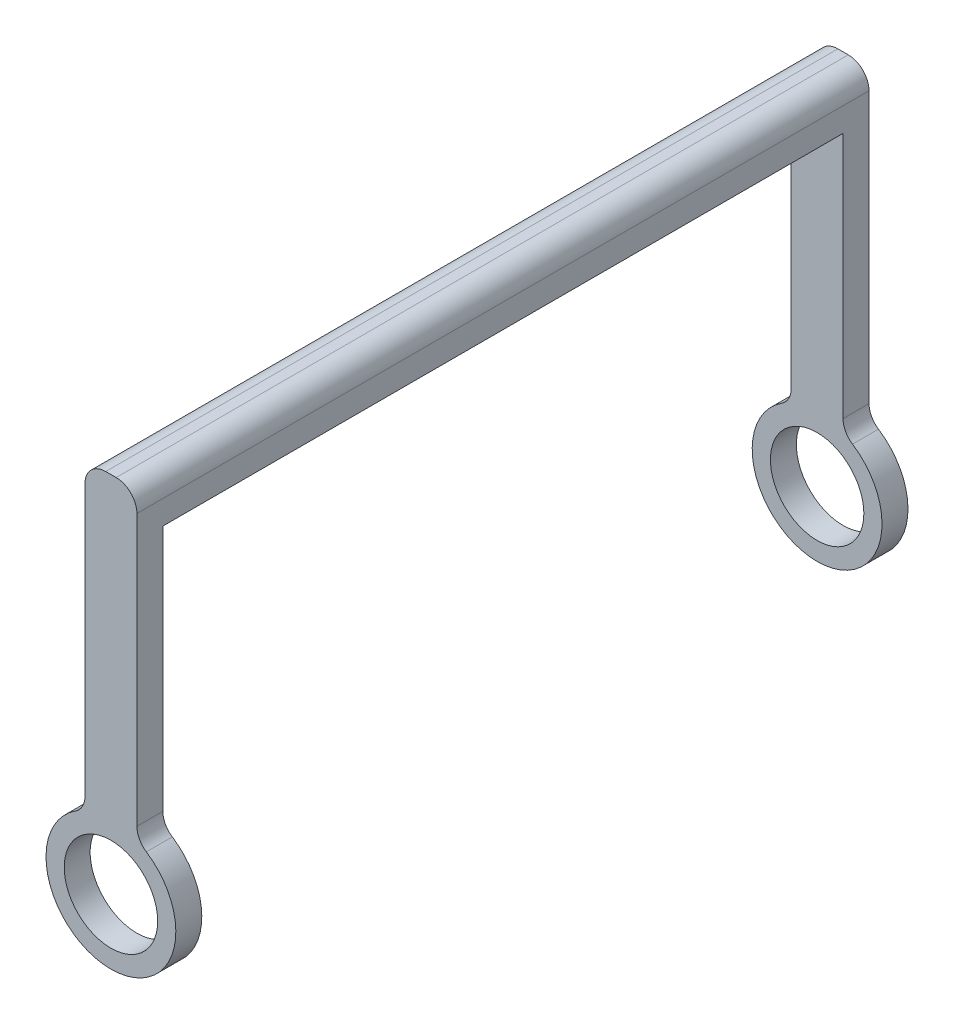
from build123d import *

# Parameters (mm, degrees)
SKETCH1_R           = 9
BOSS_EXTRUDE1_DEPTH = 2.5
BOSS_EXTRUDE2_START = 131
BOSS_EXTRUDE2_DEPTH = 131


with BuildPart() as part:
    # Sketch1 → Boss-Extrude1 (new, symmetric)
    with BuildSketch(Plane.XY):
        with BuildLine():
            Line((-5, 13.829316686), (-5, 66))
            ThreePointArc((-5, 66), (-3.828427125, 68.828427125), (-1, 70))
            Line((-1, 70), (1, 70))
            ThreePointArc((1, 70), (3.828427125, 68.828427125), (5, 66))
            Line((5, 66), (5, 13.829316686))
            ThreePointArc((5, 13.829316686), (5.483803708, 11.922391507), (6.818181818, 10.476755065))
            ThreePointArc((6.818181818, 10.476755065), (0, -12.5), (-6.818181818, 10.476755065))
            ThreePointArc((-6.818181818, 10.476755065), (-5.483803708, 11.922391507), (-5, 13.829316686))
        make_face()
        Circle(SKETCH1_R, mode=Mode.SUBTRACT)
    boss_extrude1 = extrude(amount=BOSS_EXTRUDE1_DEPTH, both=True)

    # Sketch2 → Boss-Extrude2 (add)
    with BuildSketch(Plane.XY.offset(2.5).offset(BOSS_EXTRUDE2_START)):
        with BuildLine():
            Line((-5, 66), (-5, 61.401358418))
            Line((-5, 61.401358418), (5, 61.401358418))
            Line((5, 61.401358418), (5, 66))
            ThreePointArc((5, 66), (3.828427125, 68.828427125), (1, 70))
            Line((1, 70), (-1, 70))
            ThreePointArc((-1, 70), (-3.828427125, 68.828427125), (-5, 66))
        make_face()
    extrude(amount=-BOSS_EXTRUDE2_DEPTH)

    # Mirror1: Boss-Extrude1 across plane
    add(boss_extrude1.mirror(Plane.XY.offset(68)))


solid = part.part
